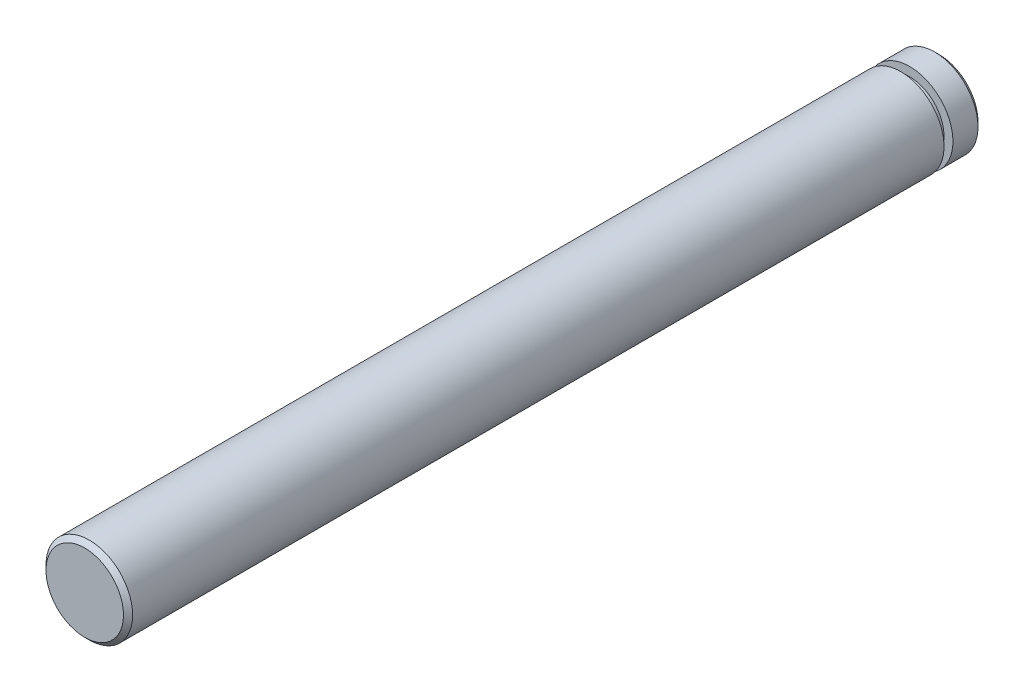
from build123d import *

# Parameters (mm, degrees)
SKETCH1_R           = 4.826
BOSS_EXTRUDE1_DEPTH = 95.25
CHAMFER1_SIZE       = 0.508
SKETCH4_W           = 0.9906
SKETCH4_H           = 0.9906


with BuildPart() as part:
    # Sketch1 → Boss-Extrude1 (new body)
    with BuildSketch(Plane.XY):
        Circle(SKETCH1_R)
    extrude(amount=BOSS_EXTRUDE1_DEPTH)

    # Chamfer1
    chamfer1_edges = [part.edges().sort_by_distance(p)[0] for p in [
        (-4.826, 0, 0),
        (-4.826, 0, 95.25),
    ]]
    chamfer(chamfer1_edges, length=CHAMFER1_SIZE)

    # Sketch4 → Cut-Revolve1 (revolve, cut)
    with BuildSketch(Plane(origin=(0, 0, 0), x_dir=(0, 0, -1), z_dir=(1, 0, 0)), mode=Mode.PRIVATE) as cut_revolve1_sk:
        with Locations((-3.7973, 4.3307)):
            Rectangle(SKETCH4_W, SKETCH4_H)
    revolve(cut_revolve1_sk.sketch.rotate(Axis((0, 0, -20.81511258), (0, 0, 1)), 90), axis=Axis((0, 0, -20.81511258), (0, 0, 1)), mode=Mode.SUBTRACT)


solid = part.part
